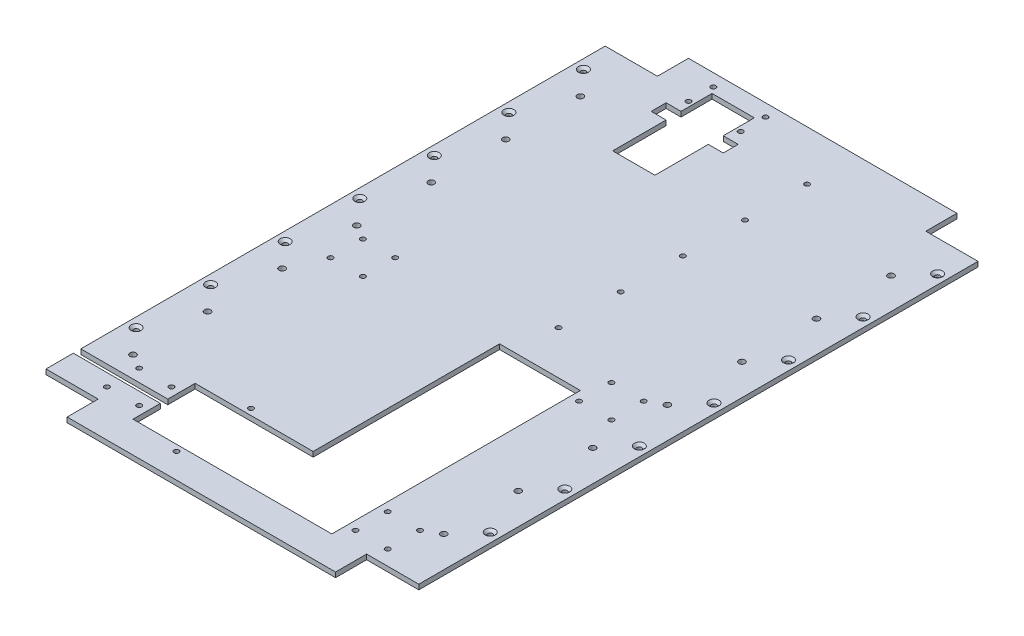
from build123d import *

# Parameters (mm, degrees)
SKETCH_1_W          = 300
SKETCH_1_H          = 500
EXTRUDE_1_DEPTH     = 4
SKETCH_2_R          = 2.5
CUT_EXTRUDE_5_DEPTH = 292.575033225
SKETCH_4_R          = 2
SKETCH_4_W          = 42
SKETCH_4_H          = 25
CUT_EXTRUDE_4_DEPTH = 292.575033225
SKETCH_5_R          = 2
CUT_EXTRUDE_6_DEPTH = 10
SKETCH_3_R          = 2
CUT_EXTRUDE_2_DEPTH = 292.575033225
CHAMFER_1_SIZE      = 2


with BuildPart() as part:
    # 草图1 → 凸台-拉伸1 (new body)
    with BuildSketch(Plane(origin=(0, 0, 0), x_dir=(1, 0, 0), z_dir=(0, 1, 0))):
        Rectangle(SKETCH_1_W, SKETCH_1_H)
    extrude(amount=EXTRUDE_1_DEPTH)

    # 草图2 → 切除-拉伸5 (cut, through all)
    with BuildSketch(Plane(origin=(0, 0, 0), x_dir=(1, 0, 0), z_dir=(0, 1, 0))):
        with Locations(Location((125, -180, 0), (0, 0, 270))):
            Circle(SKETCH_2_R)
        with Locations(Location((125, -120, 0), (0, 0, 270))):
            Circle(SKETCH_2_R)
        with Locations(Location((125, -60, 0), (0, 0, 270))):
            Circle(SKETCH_2_R)
        with Locations(Location((125, 0, 0), (0, 0, 270))):
            Circle(SKETCH_2_R)
        with Locations(Location((125, 60, 0), (0, 0, 270))):
            Circle(SKETCH_2_R)
        with Locations(Location((125, 120, 0), (0, 0, 270))):
            Circle(SKETCH_2_R)
        with Locations(Location((125, 180, 0), (0, 0, 270))):
            Circle(SKETCH_2_R)
        with Locations(Location((-125, 180, 0), (0, 0, 90))):
            Circle(SKETCH_2_R)
        with Locations(Location((-125, 120, 0), (0, 0, 90))):
            Circle(SKETCH_2_R)
        with Locations(Location((-125, 60, 0), (0, 0, 90))):
            Circle(SKETCH_2_R)
        with Locations(Location((-125, 0, 0), (0, 0, 90))):
            Circle(SKETCH_2_R)
        with Locations(Location((-125, -60, 0), (0, 0, 90))):
            Circle(SKETCH_2_R)
        with Locations(Location((-125, -120, 0), (0, 0, 90))):
            Circle(SKETCH_2_R)
        with Locations(Location((-125, -180, 0), (0, 0, 90))):
            Circle(SKETCH_2_R)
    extrude(amount=CUT_EXTRUDE_5_DEPTH, mode=Mode.SUBTRACT)

    # 草图4 → 切除-拉伸4 (cut, through all)
    with BuildSketch(Plane(origin=(0, 0, 0), x_dir=(1, 0, 0), z_dir=(0, 1, 0))):
        with Locations(Location((-78, 240, 0), (0, 0, 270))):
            Circle(SKETCH_4_R)
        with Locations(Location((-78, 220, 0), (0, 0, 270))):
            Circle(SKETCH_4_R)
        with Locations(Location((-36, 220, 0), (0, 0, 90))):
            Circle(SKETCH_4_R)
        with Locations(Location((-36, 240, 0), (0, 0, 90))):
            Circle(SKETCH_4_R)
        Polygon((-80, -175), (15, -175), (15, -25), (80, -25), (80, -225), (-80, -225), (-80, -203), (-150, -203), (-150, -197), (-80, -197), align=None)
        Polygon((-74, 235), (-40, 235), (-40, 210), (-28, 210), (-28, 198), (-40, 198), (-40, 155), (-74, 155), (-74, 198), (-86, 198), (-86, 210), (-74, 210), align=None)
        with Locations((129, 237.5)):
            Rectangle(SKETCH_4_W, SKETCH_4_H)
        with Locations((-129, 237.5)):
            Rectangle(SKETCH_4_W, SKETCH_4_H)
        with Locations((129, -237.5)):
            Rectangle(SKETCH_4_W, SKETCH_4_H)
        with Locations((-129, -237.5)):
            Rectangle(SKETCH_4_W, SKETCH_4_H)
    extrude(amount=CUT_EXTRUDE_4_DEPTH, mode=Mode.SUBTRACT)

    # 草图5 → 切除-拉伸6 (cut)
    with BuildSketch(Plane(origin=(0, 0, 0), x_dir=(1, 0, 0), z_dir=(0, 1, 0))):
        with Locations(Location((-40, -170, 0), (0, 0, 270))):
            Circle(SKETCH_5_R)
        with Locations(Location((-40, -230, 0), (0, 0, 270))):
            Circle(SKETCH_5_R)
    extrude(amount=CUT_EXTRUDE_6_DEPTH, mode=Mode.SUBTRACT)

    # 草图3 → 切除-拉伸2 (cut, through all)
    with BuildSketch(Plane(origin=(0, 0, 0), x_dir=(1, 0, 0), z_dir=(0, 1, 0))):
        with Locations(Location((-113, -187, 0), (0, 0, 270))):
            Circle(SKETCH_3_R)
        with Locations(Location((-87, -187, 0), (0, 0, 270))):
            Circle(SKETCH_3_R)
        with Locations(Location((-113, -213, 0), (0, 0, 270))):
            Circle(SKETCH_3_R)
        with Locations(Location((-87, -213, 0), (0, 0, 270))):
            Circle(SKETCH_3_R)
        with Locations(Location((-113, -7, 0), (0, 0, 270))):
            Circle(SKETCH_3_R)
        with Locations(Location((-113, -33, 0), (0, 0, 270))):
            Circle(SKETCH_3_R)
        with Locations(Location((-87, -7, 0), (0, 0, 270))):
            Circle(SKETCH_3_R)
        with Locations(Location((-87, -33, 0), (0, 0, 270))):
            Circle(SKETCH_3_R)
        with Locations(Location((87, -33, 0), (0, 0, 90))):
            Circle(SKETCH_3_R)
        with Locations(Location((87, -7, 0), (0, 0, 90))):
            Circle(SKETCH_3_R)
        with Locations(Location((113, -33, 0), (0, 0, 90))):
            Circle(SKETCH_3_R)
        with Locations(Location((113, -7, 0), (0, 0, 90))):
            Circle(SKETCH_3_R)
        with Locations(Location((87, -213, 0), (0, 0, 90))):
            Circle(SKETCH_3_R)
        with Locations(Location((113, -213, 0), (0, 0, 90))):
            Circle(SKETCH_3_R)
        with Locations(Location((87, -187, 0), (0, 0, 90))):
            Circle(SKETCH_3_R)
        with Locations(Location((113, -187, 0), (0, 0, 90))):
            Circle(SKETCH_3_R)
        with Locations(Location((-142.5, -160, 0), (0, 0, 270))):
            Circle(SKETCH_3_R)
        with Locations(Location((-142.5, -100, 0), (0, 0, 270))):
            Circle(SKETCH_3_R)
        with Locations(Location((-142.5, -40, 0), (0, 0, 270))):
            Circle(SKETCH_3_R)
        with Locations(Location((-142.5, 20, 0), (0, 0, 270))):
            Circle(SKETCH_3_R)
        with Locations(Location((-142.5, 80, 0), (0, 0, 270))):
            Circle(SKETCH_3_R)
        with Locations(Location((-142.5, 140, 0), (0, 0, 270))):
            Circle(SKETCH_3_R)
        with Locations(Location((-142.5, 200, 0), (0, 0, 270))):
            Circle(SKETCH_3_R)
        with Locations(Location((142.5, 200, 0), (0, 0, 90))):
            Circle(SKETCH_3_R)
        with Locations(Location((142.5, 140, 0), (0, 0, 90))):
            Circle(SKETCH_3_R)
        with Locations(Location((142.5, 80, 0), (0, 0, 90))):
            Circle(SKETCH_3_R)
        with Locations(Location((142.5, 20, 0), (0, 0, 90))):
            Circle(SKETCH_3_R)
        with Locations(Location((142.5, -40, 0), (0, 0, 90))):
            Circle(SKETCH_3_R)
        with Locations(Location((142.5, -100, 0), (0, 0, 90))):
            Circle(SKETCH_3_R)
        with Locations(Location((142.5, -160, 0), (0, 0, 90))):
            Circle(SKETCH_3_R)
        with Locations((27.5, -40)):
            Circle(SKETCH_3_R)
        with Locations(Location((27.5, 10, 0), (0, 0, 270))):
            Circle(SKETCH_3_R)
        with Locations(Location((27.5, 60, 0), (0, 0, 270))):
            Circle(SKETCH_3_R)
        with Locations(Location((27.5, 110, 0), (0, 0, 270))):
            Circle(SKETCH_3_R)
        with Locations(Location((27.5, 160, 0), (0, 0, 270))):
            Circle(SKETCH_3_R)
        with Locations(Location((27.5, 210, 0), (0, 0, 270))):
            Circle(SKETCH_3_R)
    extrude(amount=CUT_EXTRUDE_2_DEPTH, mode=Mode.SUBTRACT)

    # 倒角1
    chamfer_1_edges = [part.edges().sort_by_distance(p)[0] for p in [
        (-142.5, 4, -82),
        (-142.5, 4, -142),
        (-142.5, 4, -202),
        (142.5, 4, -138),
        (142.5, 4, -198),
        (-142.5, 4, 98),
        (-142.5, 4, 38),
        (-142.5, 4, -22),
        (142.5, 4, 162),
        (142.5, 4, 102),
        (142.5, 4, 42),
        (142.5, 4, -18),
        (142.5, 4, -78),
        (-142.5, 4, 158),
    ]]
    chamfer(chamfer_1_edges, length=CHAMFER_1_SIZE)


solid = part.part
